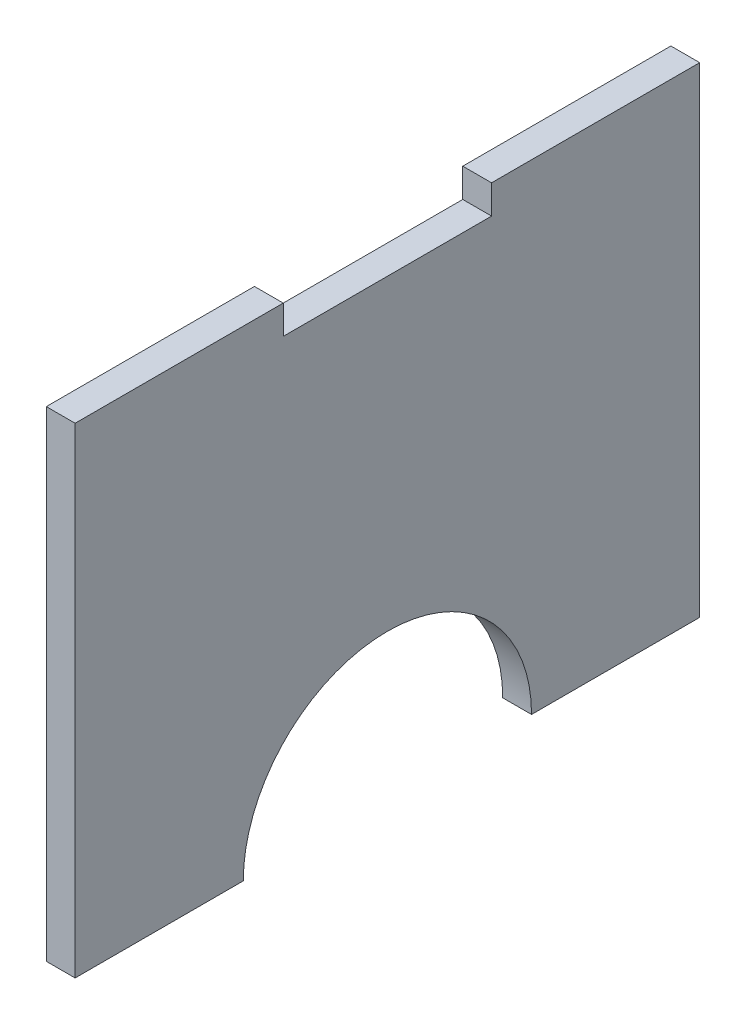
from build123d import *

# Parameters (mm, degrees)
BOSS_EXTRUDE1_DEPTH = 3


with BuildPart() as part:
    # Sketch1 → Boss-Extrude1 (new body)
    with BuildSketch(Plane(origin=(0, 0, 0), x_dir=(0, 0, -1), z_dir=(1, 0, 0))):
        with BuildLine():
            Line((-32.5, 50), (-32.5, 0))
            Line((-32.5, 0), (-15, 0))
            ThreePointArc((-15, 0), (0, 15), (15, 0))
            Line((15, 0), (32.5, 0))
            Line((32.5, 0), (32.5, 50))
            Line((32.5, 50), (10.84, 50))
            Line((10.84, 50), (10.84, 47))
            Line((10.84, 47), (-10.84, 47))
            Line((-10.84, 47), (-10.84, 50))
            Line((-10.84, 50), (-32.5, 50))
        make_face()
    extrude(amount=BOSS_EXTRUDE1_DEPTH)


solid = part.part
